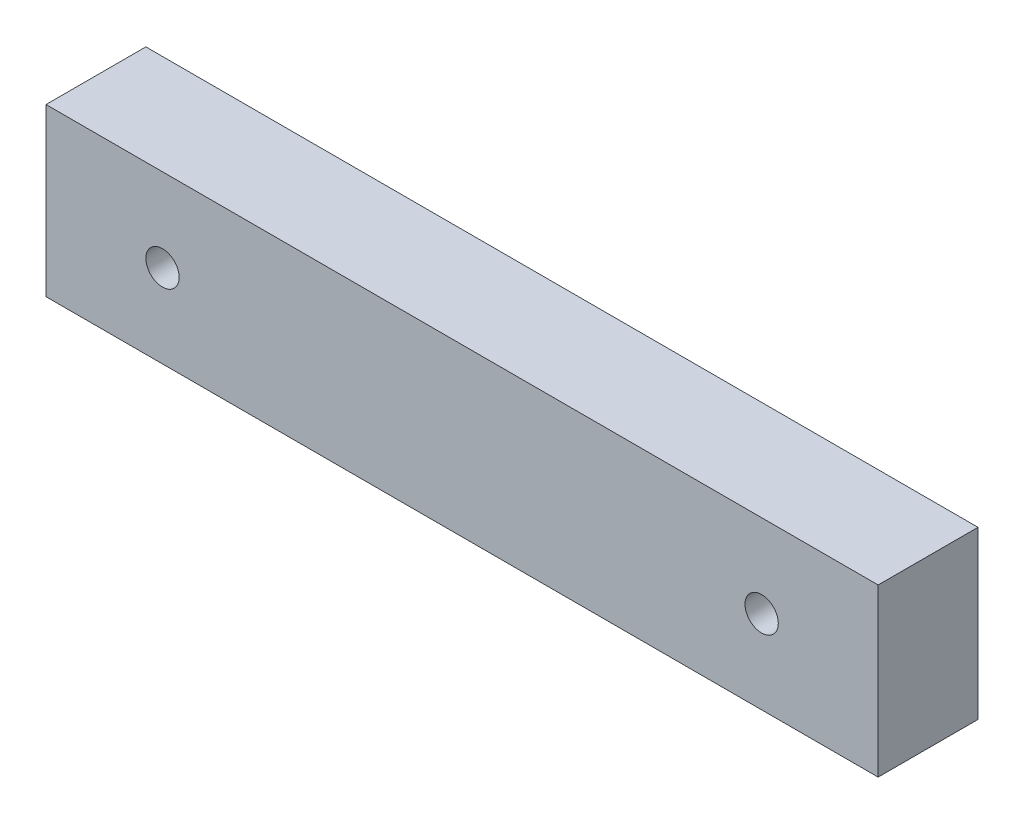
from build123d import *

# Parameters (mm, degrees)
SKETCH_1_W      = 125
SKETCH_1_H      = 25
SKETCH_1_R      = 2.5
EXTRUDE_1_DEPTH = 15


with BuildPart() as part:
    # 草图1 → 凸台-拉伸1 (new body)
    with BuildSketch(Plane.XY):
        Rectangle(SKETCH_1_W, SKETCH_1_H)
        with Locations((45, 0)):
            Circle(SKETCH_1_R, mode=Mode.SUBTRACT)
        with Locations(Location((-45, 0, 0), (0, 0, 180))):
            Circle(SKETCH_1_R, mode=Mode.SUBTRACT)
    extrude(amount=EXTRUDE_1_DEPTH)


solid = part.part
